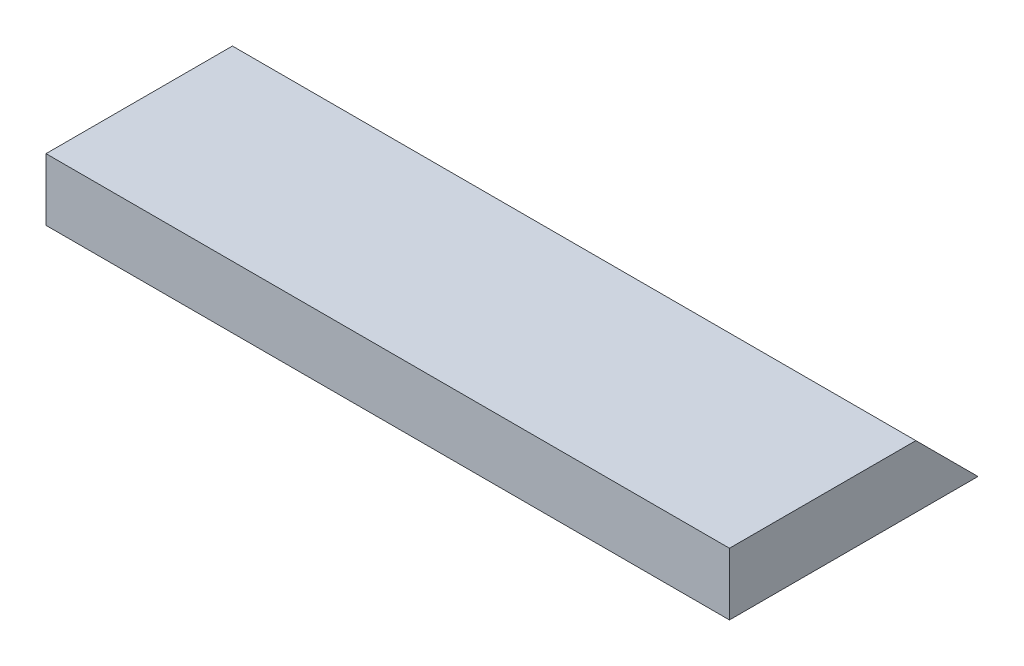
from build123d import *

# Parameters (mm, degrees)
SKETCH1_W           = 55
SKETCH1_H           = 20
BOSS_EXTRUDE1_DEPTH = 5
CUT_EXTRUDE3_REACH  = 60.737


with BuildPart() as part:
    # Sketch1 → Boss-Extrude1 (new body)
    with BuildSketch(Plane(origin=(0, 0, 0), x_dir=(1, 0, 0), z_dir=(0, 1, 0))):
        with Locations((-27.5, 10)):
            Rectangle(SKETCH1_W, SKETCH1_H)
    extrude(amount=BOSS_EXTRUDE1_DEPTH)

    # Sketch6 → Cut-Extrude3 (cut, up to next)
    with BuildSketch(Plane.ZY.offset(55), mode=Mode.PRIVATE) as cut_extrude3_sk1:
        Polygon((-20, 0), (-15, 5), (-20, 5), align=None)
    cut_extrude3_tool1 = extrude(cut_extrude3_sk1.sketch, amount=-CUT_EXTRUDE3_REACH, mode=Mode.PRIVATE) & part.part
    add(cut_extrude3_tool1.solids().sort_by_distance((-55, 3.333333, -18.333333))[0], mode=Mode.SUBTRACT)


solid = part.part
